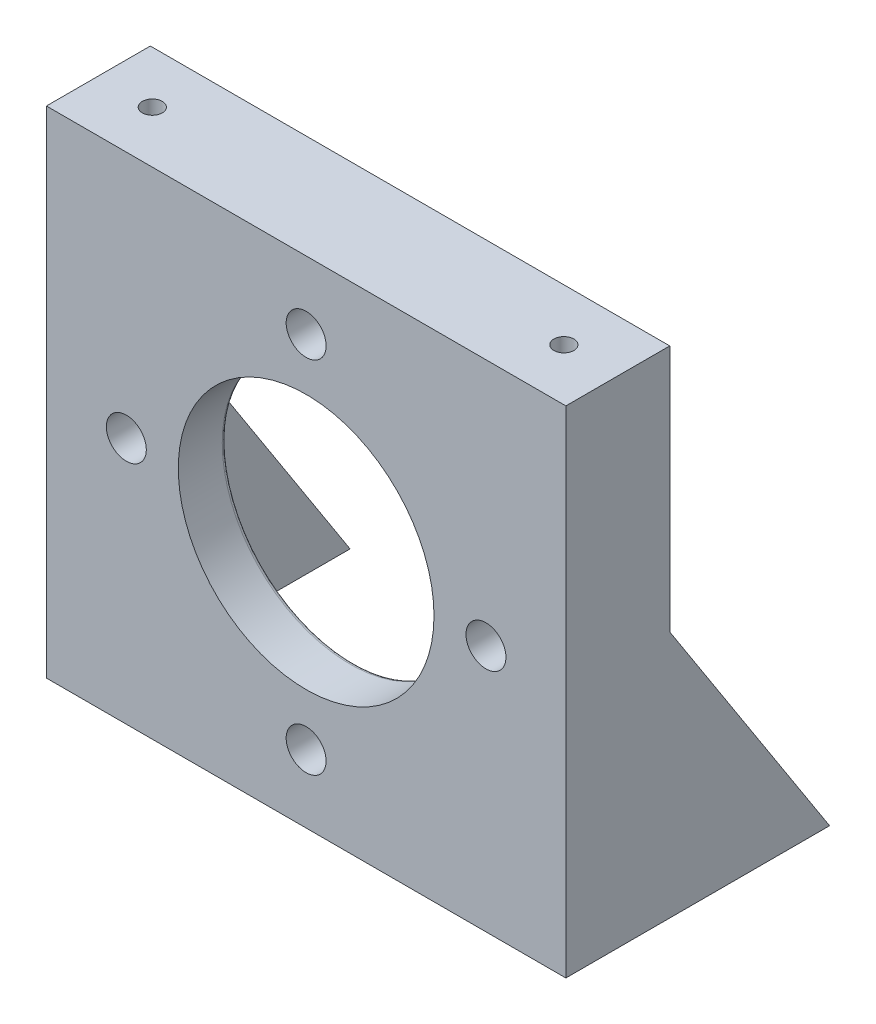
from build123d import *

# Parameters (mm, degrees)
SKETCH1_W                       = 65
SKETCH1_H                       = 62
BOSS_EXTRUDE1_DEPTH             = 13
BOSS_EXTRUDE2_REACH             = 48.757
BOSS_EXTRUDE2_DIRECTION_2_REACH = 48.757
SKETCH3_W                       = 55
SKETCH3_H                       = 20
CUT_EXTRUDE1_DEPTH              = 56.733742024
SKETCH5_R                       = 16
CUT_EXTRUDE3_DEPTH              = 56.733742024
SKETCH4_R                       = 26
CUT_EXTRUDE2_DEPTH              = 7
SKETCH6_R                       = 2.5
CUT_EXTRUDE4_DEPTH              = 56.733742024
FILLET1_R                       = 0.5
TAP_DRILL_FOR_M5X0_8_TAP1_D     = 4.2
TAP_DRILL_FOR_M5X0_8_TAP1_DEPTH = 15
TAP_DRILL_FOR_M5X0_8_TAP1_TIP   = 1.2618073
TAP_DRILL_FOR_M3X0_5_TAP1_D     = 2.5
TAP_DRILL_FOR_M3X0_5_TAP1_DEPTH = 10
TAP_DRILL_FOR_M3X0_5_TAP1_TIP   = 0.751075774
TAP_DRILL_FOR_M3X0_5_TAP2_D     = 2.5
TAP_DRILL_FOR_M3X0_5_TAP2_DEPTH = 10
TAP_DRILL_FOR_M3X0_5_TAP2_TIP   = 0.751075774


with BuildPart() as part:
    # Sketch1 → Boss-Extrude1 (new body)
    with BuildSketch(Plane.XY):
        Rectangle(SKETCH1_W, SKETCH1_H)
    extrude(amount=-BOSS_EXTRUDE1_DEPTH)

    # Boss-Extrude2: up to this face of the body (flat: up to its plane)
    boss_extrude2_end = Plane(part.part.faces().sort_by_distance((32.5, 0, -6.5))[0])
    # Sketch2 → Boss-Extrude2 (add, up to the picked face)
    with BuildSketch(Plane(origin=(0, 0, 0), x_dir=(0, 0, -1), z_dir=(1, 0, 0)), mode=Mode.PRIVATE) as boss_extrude2_sk1:
        Polygon((13, 0), (33, -31), (13, -31), align=None)
    boss_extrude2_tool1 = split(extrude(boss_extrude2_sk1.sketch, amount=BOSS_EXTRUDE2_REACH, mode=Mode.PRIVATE), bisect_by=boss_extrude2_end, keep=Keep.BOTH, mode=Mode.PRIVATE)
    add(boss_extrude2_tool1.solids().sort_by(Axis((0, -20.666667, -19.666667), (1, 0, 0)))[0])

    # Boss-Extrude2 direction 2: up to this face of the body (flat: up to its plane)
    boss_extrude2_direction_2_end = Plane(part.part.faces().sort_by_distance((-32.5, 0, -6.5))[0])
    # Sketch2 → Boss-Extrude2 direction 2 (add, up to the picked face)
    with BuildSketch(Plane(origin=(0, 0, 0), x_dir=(0, 0, -1), z_dir=(1, 0, 0)), mode=Mode.PRIVATE) as boss_extrude2_direction_2_sk1:
        Polygon((13, 0), (33, -31), (13, -31), align=None)
    boss_extrude2_direction_2_tool1 = split(extrude(boss_extrude2_direction_2_sk1.sketch, amount=-BOSS_EXTRUDE2_DIRECTION_2_REACH, mode=Mode.PRIVATE), bisect_by=boss_extrude2_direction_2_end, keep=Keep.BOTH, mode=Mode.PRIVATE)
    add(boss_extrude2_direction_2_tool1.solids().sort_by(Axis((0, -20.666667, -19.666667), (-1, 0, 0)))[0])

    # Sketch3 → Cut-Extrude1 (cut, through all)
    with BuildSketch(Plane(origin=(0, 0, 0), x_dir=(1, 0, 0), z_dir=(0, 1, 0))):
        with Locations((0, 23)):
            Rectangle(SKETCH3_W, SKETCH3_H)
    extrude(amount=-CUT_EXTRUDE1_DEPTH, mode=Mode.SUBTRACT)

    # Sketch5 → Cut-Extrude3 (cut, through all)
    with BuildSketch(Plane.XY):
        Circle(SKETCH5_R)
    extrude(amount=-CUT_EXTRUDE3_DEPTH, mode=Mode.SUBTRACT)

    # Sketch4 → Cut-Extrude2 (cut)
    with BuildSketch(Plane(origin=(0, 0, -13), x_dir=(-1, 0, 0), z_dir=(0, 0, -1))):
        Circle(SKETCH4_R)
    extrude(amount=-CUT_EXTRUDE2_DEPTH, mode=Mode.SUBTRACT)

    # Sketch6 → Cut-Extrude4 (cut, through all)
    with BuildSketch(Plane.XY):
        with Locations((0, 22.5)):
            Circle(SKETCH6_R)
        with Locations((22.5, 0)):
            Circle(SKETCH6_R)
        with Locations((0, -22.5)):
            Circle(SKETCH6_R)
        with Locations((-22.5, 0)):
            Circle(SKETCH6_R)
    extrude(amount=-CUT_EXTRUDE4_DEPTH, mode=Mode.SUBTRACT)

    # Fillet1
    fillet1_edges = [part.edges().sort_by_distance(p)[0] for p in [
        (26, 0, -13),
        (26, 0, -6),
        (-16, 0, -6),
    ]]
    fillet(fillet1_edges, radius=FILLET1_R)

    # Tap Drill for M5x0.8 Tap1
    with Locations(Plane(origin=(0, -31, 0), x_dir=(-1, 0, 0), z_dir=(0, -1, 0))):
        with Locations((27, 6.5), (-27, 6.5)):
            Hole(TAP_DRILL_FOR_M5X0_8_TAP1_D / 2, depth=TAP_DRILL_FOR_M5X0_8_TAP1_DEPTH)
            with Locations((0, 0, -(TAP_DRILL_FOR_M5X0_8_TAP1_DEPTH + TAP_DRILL_FOR_M5X0_8_TAP1_TIP / 2))):  # 118° drill point
                Cone(0, TAP_DRILL_FOR_M5X0_8_TAP1_D / 2, TAP_DRILL_FOR_M5X0_8_TAP1_TIP, mode=Mode.SUBTRACT)

    # Tap Drill for M3x0.5 Tap1
    with Locations(Plane(origin=(0, -31, 0), x_dir=(-1, 0, 0), z_dir=(0, -1, 0))):
        with Locations((30, 21.65), (-30, 21.65)):
            Hole(TAP_DRILL_FOR_M3X0_5_TAP1_D / 2, depth=TAP_DRILL_FOR_M3X0_5_TAP1_DEPTH)
            with Locations((0, 0, -(TAP_DRILL_FOR_M3X0_5_TAP1_DEPTH + TAP_DRILL_FOR_M3X0_5_TAP1_TIP / 2))):  # 118° drill point
                Cone(0, TAP_DRILL_FOR_M3X0_5_TAP1_D / 2, TAP_DRILL_FOR_M3X0_5_TAP1_TIP, mode=Mode.SUBTRACT)

    # Tap Drill for M3x0.5 Tap2
    with Locations(Plane(origin=(0, 31, 0), x_dir=(1, 0, 0), z_dir=(0, 1, 0))):
        with Locations((25.75, 6.5), (-25.75, 6.5)):
            Hole(TAP_DRILL_FOR_M3X0_5_TAP2_D / 2, depth=TAP_DRILL_FOR_M3X0_5_TAP2_DEPTH)
            with Locations((0, 0, -(TAP_DRILL_FOR_M3X0_5_TAP2_DEPTH + TAP_DRILL_FOR_M3X0_5_TAP2_TIP / 2))):  # 118° drill point
                Cone(0, TAP_DRILL_FOR_M3X0_5_TAP2_D / 2, TAP_DRILL_FOR_M3X0_5_TAP2_TIP, mode=Mode.SUBTRACT)


solid = part.part
